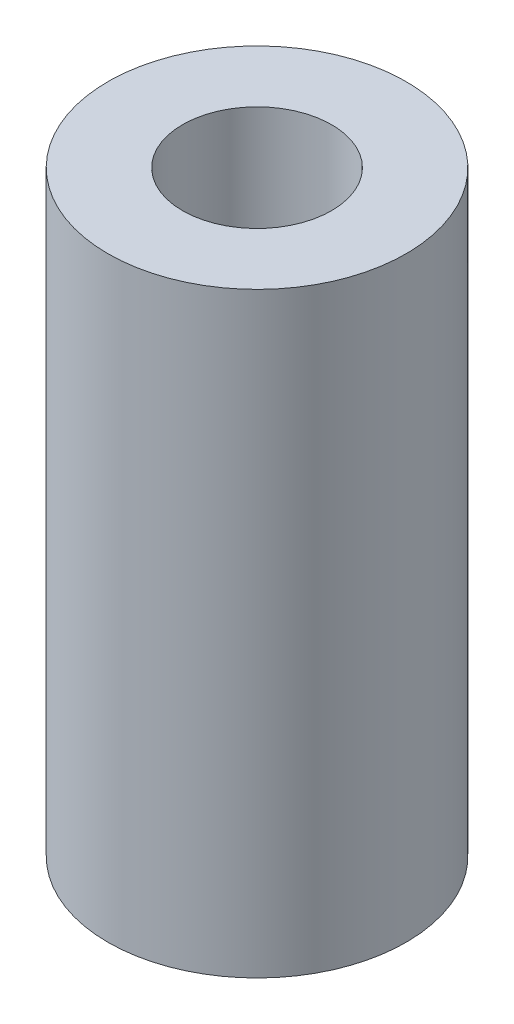
from build123d import *

# Parameters (mm, degrees)
SKETCH1_R           = 3.175
SKETCH1_R_2         = 1.5875
BOSS_EXTRUDE1_DEPTH = 12.7


with BuildPart() as part:
    # Sketch1 → Boss-Extrude1 (new body)
    with BuildSketch(Plane(origin=(0, 0, 0), x_dir=(1, 0, 0), z_dir=(0, 1, 0))):
        with Locations(Location((0, 0, 0), (0, 0, 270))):
            Circle(SKETCH1_R)
        with Locations(Location((0, 0, 0), (0, 0, 270))):
            Circle(SKETCH1_R_2, mode=Mode.SUBTRACT)
    extrude(amount=BOSS_EXTRUDE1_DEPTH)


solid = part.part
